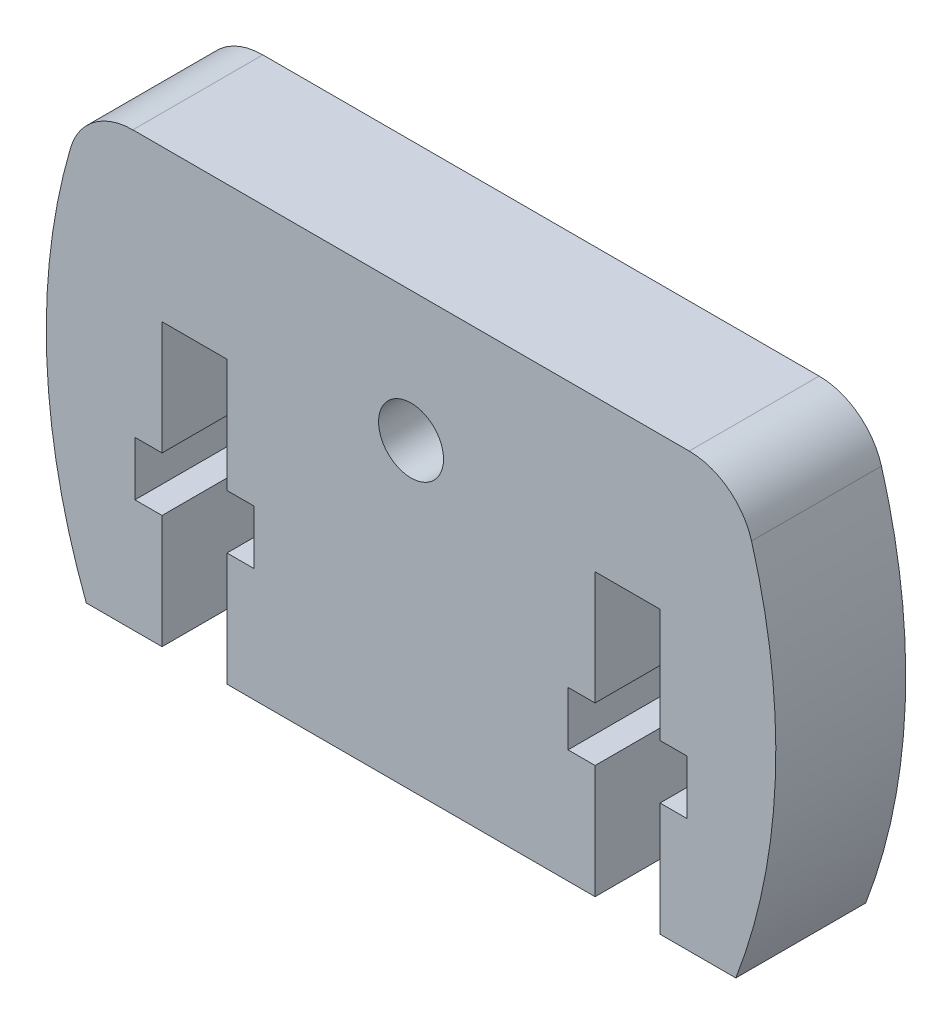
from build123d import *

# Parameters (mm, degrees)
SKETCH_1_R      = 1.5
EXTRUDE_1_DEPTH = 6


with BuildPart() as part:
    # Эскиз1 → Бобышка-Вытянуть1 (new body)
    with BuildSketch(Plane.XY):
        with BuildLine():
            Line((0, 0), (3.5, 0))
            Line((3.5, 0), (3.5, 5.25))
            Line((3.5, 5.25), (2.25, 5.25))
            Line((2.25, 5.25), (2.25, 7.75))
            Line((2.25, 7.75), (3.5, 7.75))
            Line((3.5, 7.75), (3.5, 13))
            Line((3.5, 13), (6.5, 13))
            Line((6.5, 13), (6.5, 7.75))
            Line((6.5, 7.75), (7.75, 7.75))
            Line((7.75, 7.75), (7.75, 5.25))
            Line((7.75, 5.25), (6.5, 5.25))
            Line((6.5, 5.25), (6.5, 0))
            Line((6.5, 0), (23.5, 0))
            Line((23.5, 0), (23.5, 5.25))
            Line((23.5, 5.25), (22.25, 5.25))
            Line((22.25, 5.25), (22.25, 7.75))
            Line((22.25, 7.75), (23.5, 7.75))
            Line((23.5, 7.75), (23.5, 13))
            Line((23.5, 13), (26.5, 13))
            Line((26.5, 13), (26.5, 7.75))
            Line((26.5, 7.75), (27.75, 7.75))
            Line((27.75, 7.75), (27.75, 5.25))
            Line((27.75, 5.25), (26.5, 5.25))
            Line((26.5, 5.25), (26.5, 0))
            Line((26.5, 0), (30, 0))
            ThreePointArc((30, 0), (31.823751247, 8.860593438), (30.726698908, 17.840162517))
            ThreePointArc((30.726698908, 17.840162517), (29.646678597, 19.400050786), (27.846746313, 20))
            Line((27.846746313, 20), (2.153253687, 20))
            ThreePointArc((2.153253687, 20), (0.353321403, 19.400050786), (-0.726698908, 17.840162517))
            ThreePointArc((-0.726698908, 17.840162517), (-1.823751247, 8.860593438), (0, 0))
        make_face()
        with Locations((15, 14)):
            Circle(SKETCH_1_R, mode=Mode.SUBTRACT)
    extrude(amount=EXTRUDE_1_DEPTH)


solid = part.part
